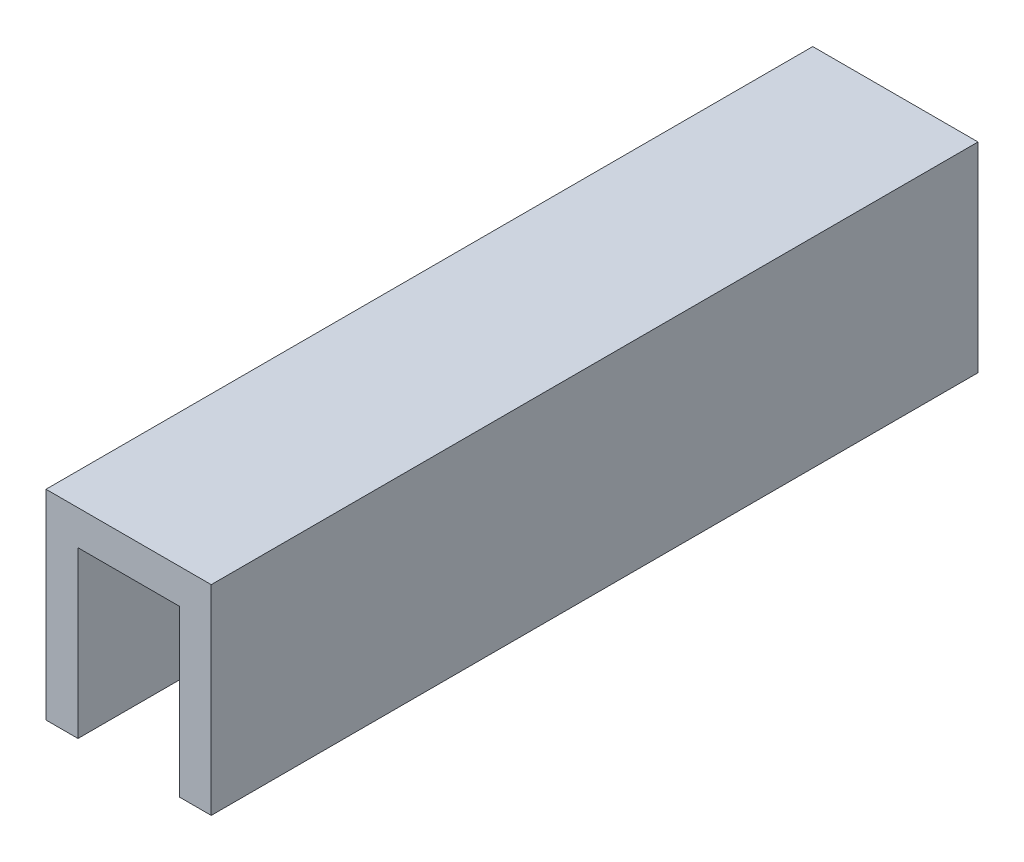
from build123d import *


with BuildPart() as part:
    # Sweep3: sweep along a path in Sketch3
    with BuildLine(Plane(origin=(0, 0, 0), x_dir=(0, 0, -1), z_dir=(1, 0, 0))) as sweep3_path:
        Line((0, 0), (-36.5379, 0))
    # Sketch2 → Sweep3 (sweep)
    with BuildSketch(Plane.XY):
        Polygon((0, 0), (4.826, 0), (4.826, -7.874), (6.35, -7.874), (6.35, 1.651), (-1.524, 1.651), (-1.524, -7.874), (0, -7.874), align=None)
    sweep(path=sweep3_path.line)


solid = part.part
